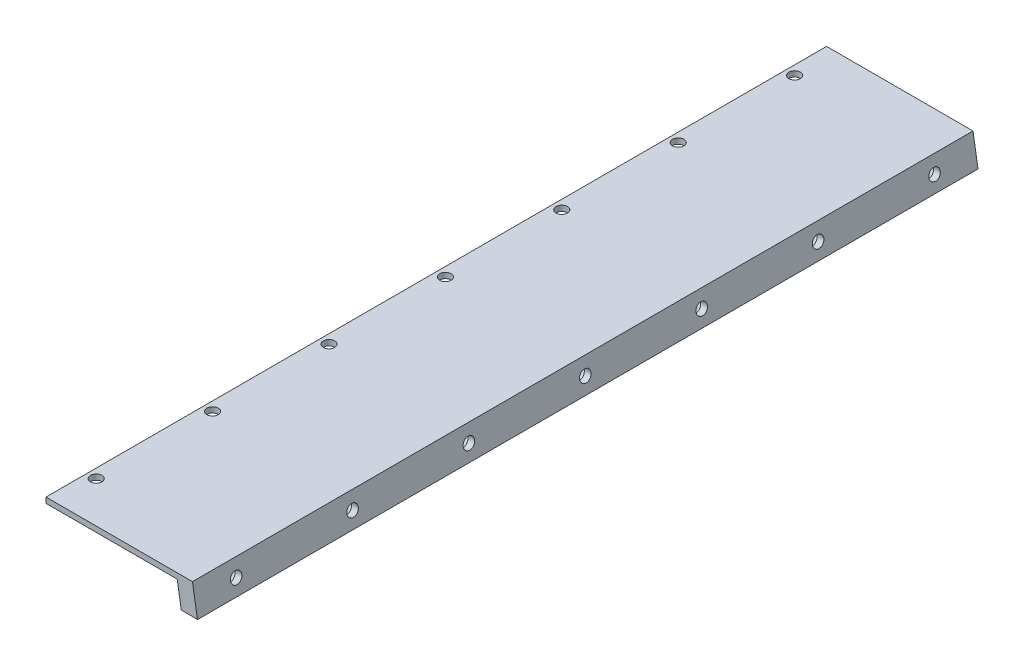
from build123d import *

# Parameters (mm, degrees)
BOSS_EXTRUDE1_DEPTH = 171
SKETCH2_R           = 1.25
CUT_EXTRUDE1_DEPTH  = 50
SKETCH3_R           = 1.25
CUT_EXTRUDE2_DEPTH  = 50
CUT_EXTRUDE3_DEPTH  = 2
LPATTERN1_COUNT     = 7
LPATTERN1_PITCH     = 25.5


with BuildPart() as part:
    # Sketch1 → Boss-Extrude1 (new body)
    with BuildSketch(Plane.XY):
        Polygon((0, 0), (32.09, 0), (33.178500502, -6.66165645), (29.624787969, -6.61699683), (28.739662203, -1.2), (0, -1.2), align=None)
    extrude(amount=BOSS_EXTRUDE1_DEPTH)

    # Sketch2 → Cut-Extrude1 (cut)
    with BuildSketch(Plane(origin=(0, 0, 0), x_dir=(1, 0, 0), z_dir=(0, 1, 0))):
        with Locations(Location((2, -9, 0), (0, 0, 270))):
            Circle(SKETCH2_R)
    cut_extrude1 = extrude(amount=-CUT_EXTRUDE1_DEPTH, mode=Mode.SUBTRACT)

    # Sketch3 → Cut-Extrude2 (cut)
    with BuildSketch(Plane(origin=(31.255513263, 5.107084422, 0), x_dir=(0, 0, -1), z_dir=(0.9869120666582158, 0.16125933363501674, 0))):
        with Locations(Location((-9, -8.674812016, 0), (0, 0, 90))):
            Circle(SKETCH3_R)
    cut_extrude2 = extrude(amount=-CUT_EXTRUDE2_DEPTH, mode=Mode.SUBTRACT)

    # Sketch4 → Cut-Extrude3 (cut)
    with BuildSketch(Plane(origin=(27.801321029, 4.542676754, 0), x_dir=(0, 0, 1), z_dir=(-0.9869120666582157, -0.1612593336350174, 0))):
        Polygon((7.816431948, -6.624812016), (6.632863896, -8.674812016), (7.816431948, -10.724812016), (10.183568052, -10.724812016), (11.367136104, -8.674812016), (10.183568052, -6.624812016), align=None)
    cut_extrude3 = extrude(amount=-CUT_EXTRUDE3_DEPTH, mode=Mode.SUBTRACT)

    # LPattern1: Cut-Extrude1, Cut-Extrude2, Cut-Extrude3 ×7
    with Locations(*[(0, 0, i * LPATTERN1_PITCH) for i in range(1, LPATTERN1_COUNT)]):
        add(cut_extrude1, mode=Mode.SUBTRACT)
        add(cut_extrude2, mode=Mode.SUBTRACT)
        add(cut_extrude3, mode=Mode.SUBTRACT)


solid = part.part
